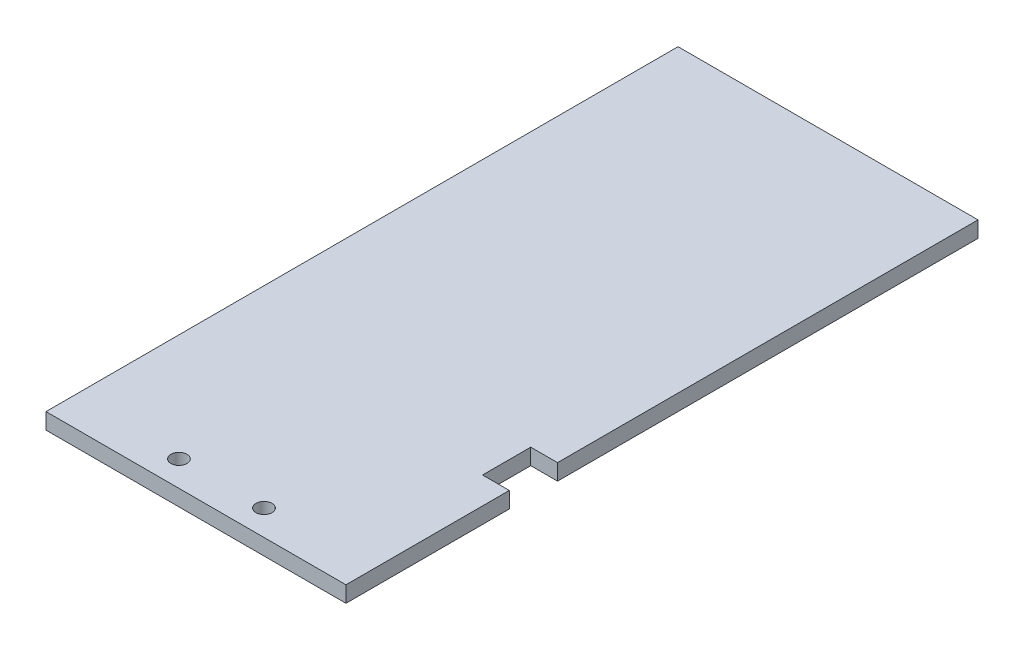
from build123d import *

# Parameters (mm, degrees)
SKETCH1_W             = 56
SKETCH1_H             = 98
BOSS_EXTRUDE1_DEPTH   = 3
SKETCH4_W             = 56
SKETCH4_H             = 3
BOSS_EXTRUDE3_DEPTH   = 20
SKETCH9_W             = 5
SKETCH9_H             = 9
CUT_EXTRUDE1_DEPTH    = 10
CROQUIS1_R            = 1.5
CORTAR_EXTRUIR1_DEPTH = 10


with BuildPart() as part:
    # Sketch1 → Boss-Extrude1 (new body)
    with BuildSketch(Plane(origin=(0, 0, 0), x_dir=(1, 0, 0), z_dir=(0, 1, 0))):
        with Locations((28, 49)):
            Rectangle(SKETCH1_W, SKETCH1_H)
    extrude(amount=BOSS_EXTRUDE1_DEPTH)

    # Sketch4 → Boss-Extrude3 (add)
    with BuildSketch(Plane.XY):
        with Locations((28, 1.5)):
            Rectangle(SKETCH4_W, SKETCH4_H)
    extrude(amount=BOSS_EXTRUDE3_DEPTH)

    # Sketch9 → Cut-Extrude1 (cut)
    with BuildSketch(Plane(origin=(0, 3, 0), x_dir=(1, 0, 0), z_dir=(0, 1, 0))):
        with Locations((53.5, 15)):
            Rectangle(SKETCH9_W, SKETCH9_H)
    extrude(amount=-CUT_EXTRUDE1_DEPTH, mode=Mode.SUBTRACT)

    # Croquis1 → Cortar-Extruir1 (cut)
    with BuildSketch(Plane(origin=(0, 3, 0), x_dir=(1, 0, 0), z_dir=(0, 1, 0))):
        with Locations(Location((20.06, -15.24, 0), (0, 0, 270))):
            Circle(CROQUIS1_R)
        with Locations(Location((35.94, -15.24, 0), (0, 0, 90))):
            Circle(CROQUIS1_R)
    extrude(amount=-CORTAR_EXTRUIR1_DEPTH, mode=Mode.SUBTRACT)


solid = part.part
